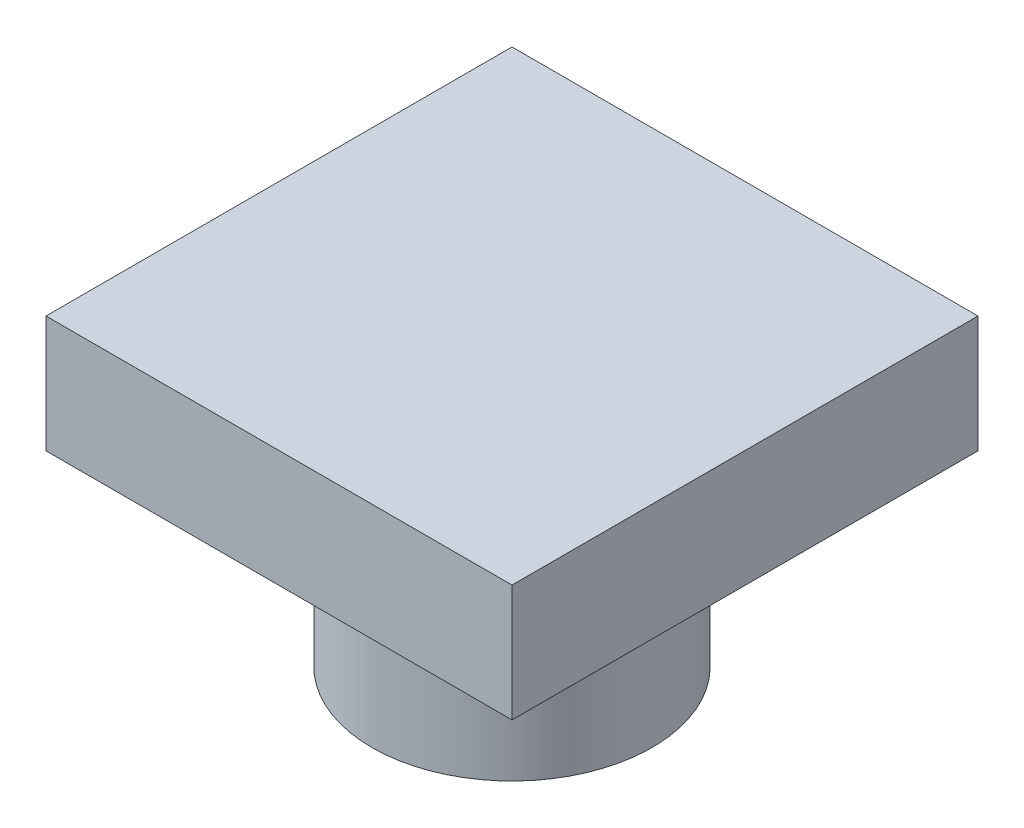
from build123d import *

# Parameters (mm, degrees)
CROQUIS1_W              = 6
CROQUIS1_H              = 8
CROQUIS2_W              = 19.95
CROQUIS2_H              = 19.95
SALIENTE_EXTRUIR1_DEPTH = 5
SKETCH6_R               = 4
CUT_EXTRUDE1_DEPTH      = 10.5


with BuildPart() as part:
    # Croquis1 → Revolución1 (revolve)
    with BuildSketch(Plane(origin=(0, 0, 0), x_dir=(0, 0, -1), z_dir=(1, 0, 0)), mode=Mode.PRIVATE) as revoluci_n1_sk:
        with Locations((-3, 4)):
            Rectangle(CROQUIS1_W, CROQUIS1_H)
    revolve(revoluci_n1_sk.sketch.rotate(Axis((0, 0, 0), (0, 1, 0)), 180), axis=Axis((0, 0, 0), (0, 1, 0)))

    # Croquis2 → Saliente-Extruir1 (add)
    with BuildSketch(Plane(origin=(0, 8, 0), x_dir=(1, 0, 0), z_dir=(0, 1, 0))):
        Rectangle(CROQUIS2_W, CROQUIS2_H)
    extrude(amount=SALIENTE_EXTRUIR1_DEPTH)

    # Sketch6 → Cut-Extrude1 (cut)
    with BuildSketch(Plane.XZ):
        with Locations(Location((0, 0, 0), (0, 0, 270))):
            Circle(SKETCH6_R)
    extrude(amount=-CUT_EXTRUDE1_DEPTH, mode=Mode.SUBTRACT)


solid = part.part
